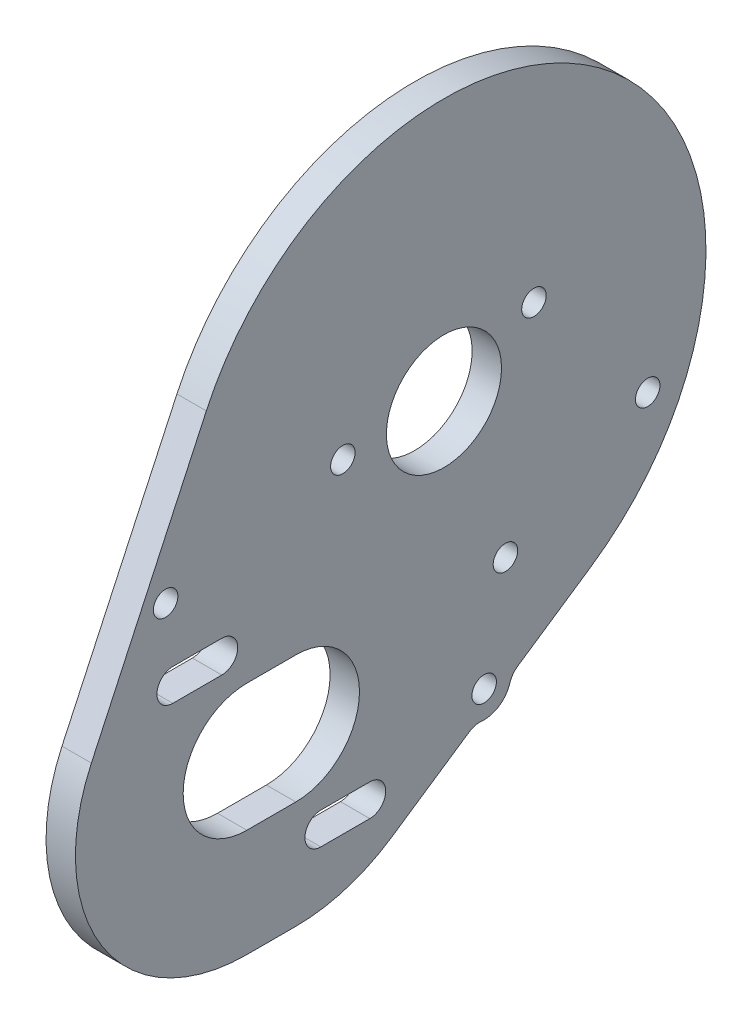
from build123d import *

# Parameters (mm, degrees)
SKETCH3_R           = 1.25
SKETCH3_R_2         = 5.875
BOSS_EXTRUDE2_DEPTH = 3


with BuildPart() as part:
    # Sketch3 → Boss-Extrude2 (new body)
    with BuildSketch(Plane(origin=(0, 0, 0), x_dir=(0, 0, -1), z_dir=(1, 0, 0))):
        with BuildLine():
            Line((-24.261559398, 11.266731363), (-35.997048204, -14.004241165))
            ThreePointArc((-35.997048204, -14.004241165), (-34.876919869, -30.789396433), (-20.125, -38.875))
            Line((-20.125, -38.875), (-15.125, -38.875))
            ThreePointArc((-15.125, -38.875), (-10.004093471, -38.108986863), (-5.33149342, -35.87800758))
            Line((-5.33149342, -35.87800758), (2.552389063, -30.554225285))
            ThreePointArc((2.552389063, -30.554225285), (3.174199215, -30.274562996), (3.853820115, -30.220025911))
            ThreePointArc((3.853820115, -30.220025911), (5.64328781, -29.760501772), (6.738132443, -28.272324263))
            ThreePointArc((6.738132443, -28.272324263), (7.042647171, -27.662299968), (7.534383085, -27.190013348))
            Line((7.534383085, -27.190013348), (14.970074344, -22.168883015))
            ThreePointArc((14.970074344, -22.168883015), (17.351311214, 20.359137977), (-24.261559398, 11.266731363))
        make_face()
        with BuildLine():
            Line((-20.125, -14.875), (-15.125, -14.875))
            ThreePointArc((-15.125, -14.875), (-8.625, -21.375), (-15.125, -27.875))
            Line((-15.125, -27.875), (-20.125, -27.875))
            ThreePointArc((-20.125, -27.875), (-26.625, -21.375), (-20.125, -14.875))
        make_face(mode=Mode.SUBTRACT)
        with BuildLine():
            Line((-22.679384039, -12.875), (-27.679384039, -12.875))
            ThreePointArc((-27.679384039, -12.875), (-29.304384039, -11.25), (-27.679384039, -9.625))
            Line((-27.679384039, -9.625), (-22.679384039, -9.625))
            ThreePointArc((-22.679384039, -9.625), (-21.054384039, -11.25), (-22.679384039, -12.875))
        make_face(mode=Mode.SUBTRACT)
        with Locations((4.104308205, -27.481457724)):
            Circle(SKETCH3_R, mode=Mode.SUBTRACT)
        with Locations((6.277610864, -16.958330561)):
            Circle(SKETCH3_R, mode=Mode.SUBTRACT)
        with Locations((20.80047509, -9.625)):
            Circle(SKETCH3_R, mode=Mode.SUBTRACT)
        with Locations((-10.322617138, 0)):
            Circle(SKETCH3_R, mode=Mode.SUBTRACT)
        Circle(SKETCH3_R_2, mode=Mode.SUBTRACT)
        with Locations((9.189505152, 4.140062296)):
            Circle(SKETCH3_R, mode=Mode.SUBTRACT)
        with BuildLine():
            Line((-7.570615961, -33.125), (-12.570615961, -33.125))
            ThreePointArc((-12.570615961, -33.125), (-14.195615961, -31.5), (-12.570615961, -29.875))
            Line((-12.570615961, -29.875), (-7.570615961, -29.875))
            ThreePointArc((-7.570615961, -29.875), (-5.945615961, -31.5), (-7.570615961, -33.125))
        make_face(mode=Mode.SUBTRACT)
        with Locations((-28.41801633, -3.655785684)):
            Circle(SKETCH3_R, mode=Mode.SUBTRACT)
    extrude(amount=BOSS_EXTRUDE2_DEPTH)


solid = part.part
